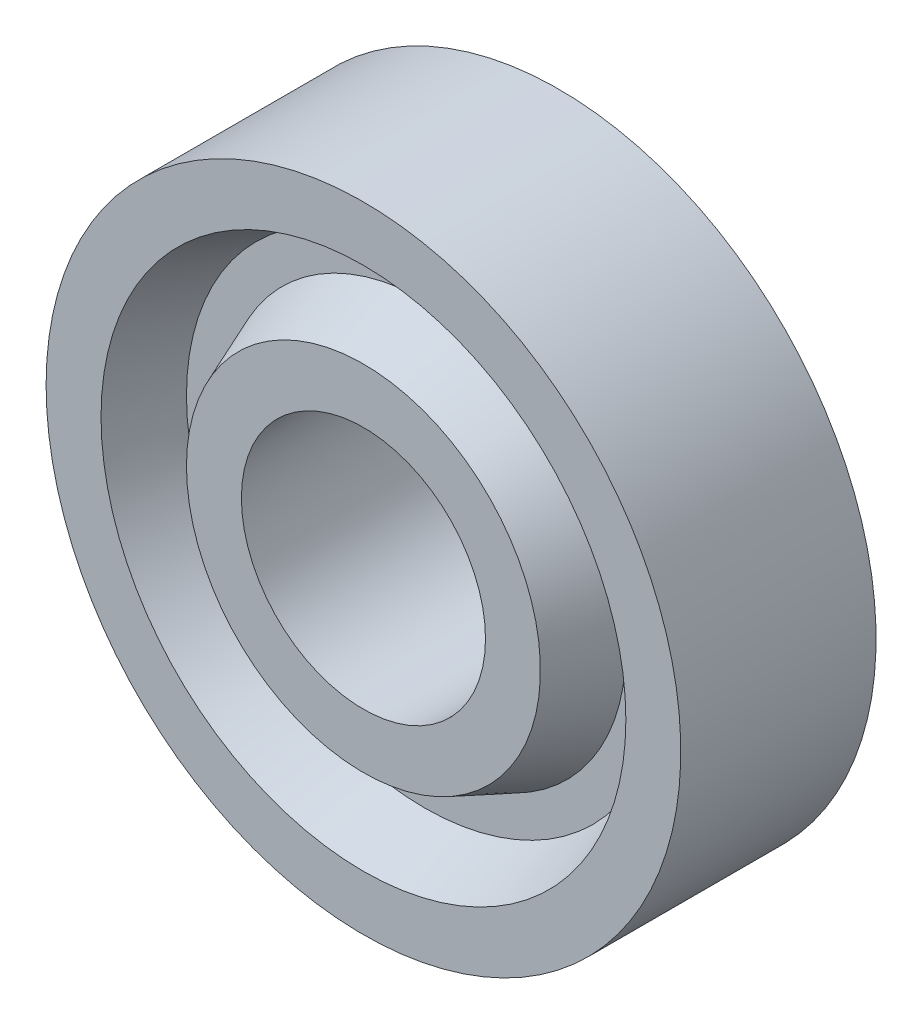
from build123d import *


with BuildPart() as part:
    # Sketch1 → Revolve1 (revolve)
    with BuildSketch(Plane(origin=(0, 0, 0), x_dir=(1, 0, 0), z_dir=(0, 1, 0)), mode=Mode.PRIVATE) as revolve1_sk:
        Polygon((7.25, 4), (8.25, 1.5), (9.75, 1.5), (10.75, 4), (13, 4), (13, -4), (10.75, -4), (9.75, -1.5), (8.25, -1.5), (7.25, -4), (5, -4), (5, 4), align=None)
    revolve(revolve1_sk.sketch.rotate(Axis((0, 0, -28.911106653), (0, 0, 1)), 180), axis=Axis((0, 0, -28.911106653), (0, 0, 1)))


solid = part.part
